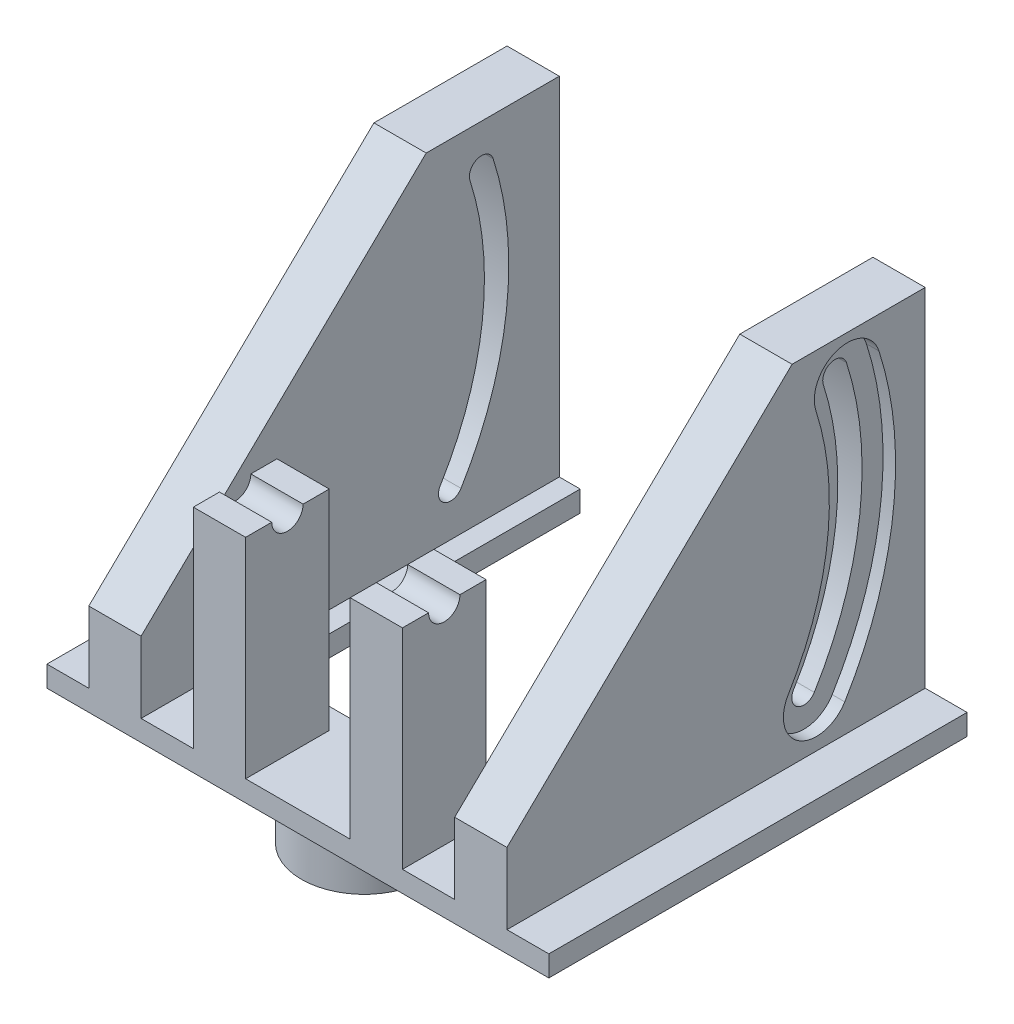
from build123d import *

# Parameters (mm, degrees)
AUFSATZ_LINEAR_AUSTRAGEN1_DEPTH = 10
SKIZZE2_W                       = 25
SKIZZE2_H                       = 40
AUFSATZ_LINEAR_AUSTRAGEN2_DEPTH = 100
SKIZZE3_R                       = 7.5
SCHNITT_LINEAR_AUSTRAGEN1_DEPTH = 285.604989415
SKIZZE4_W                       = 25
SKIZZE4_H                       = 200
AUFSATZ_LINEAR_AUSTRAGEN3_DEPTH = 200
SCHNITT_LINEAR_AUSTRAGEN4_REACH = 365.992
SCHNITT_LINEAR_AUSTRAGEN3_DEPTH = 364.992344743
SCHNITT_LINEAR_AUSTRAGEN5_DEPTH = 6
SKIZZE9_R                       = 30
AUFSATZ_LINEAR_AUSTRAGEN4_DEPTH = 20


with BuildPart() as part:
    # Skizze1 → Aufsatz-Linear austragen1 (new body)
    with BuildSketch(Plane(origin=(0, 0, 0), x_dir=(1, 0, 0), z_dir=(0, 1, 0))):
        Polygon((0, 0), (240, 0), (240, 200), (185, 200), (185, 50), (55, 50), (55, 200), (0, 200), align=None)
    extrude(amount=AUFSATZ_LINEAR_AUSTRAGEN1_DEPTH)

    # Skizze2 → Aufsatz-Linear austragen2 (add)
    with BuildSketch(Plane(origin=(0, 10, 0), x_dir=(1, 0, 0), z_dir=(0, 1, 0))):
        with Locations((157.5, 20)):
            Rectangle(SKIZZE2_W, SKIZZE2_H)
        with Locations((82.5, 20)):
            Rectangle(SKIZZE2_W, SKIZZE2_H)
    extrude(amount=AUFSATZ_LINEAR_AUSTRAGEN2_DEPTH)

    # Skizze3 → Schnitt-Linear austragen1 (cut, through all)
    with BuildSketch(Plane(origin=(170, 0, 0), x_dir=(0, 0, -1), z_dir=(1, 0, 0))):
        with Locations((20, 110)):
            Circle(SKIZZE3_R)
    extrude(amount=-SCHNITT_LINEAR_AUSTRAGEN1_DEPTH, mode=Mode.SUBTRACT)

    # Skizze4 → Aufsatz-Linear austragen3 (add)
    with BuildSketch(Plane(origin=(0, 10, 0), x_dir=(1, 0, 0), z_dir=(0, 1, 0))):
        with Locations((207.478242177, 100)):
            Rectangle(SKIZZE4_W, SKIZZE4_H)
        with Locations((32.521757823, 100)):
            Rectangle(SKIZZE4_W, SKIZZE4_H)
    extrude(amount=AUFSATZ_LINEAR_AUSTRAGEN3_DEPTH)

    # Skizze7 → Schnitt-Linear austragen4 (cut, up to next)
    with BuildSketch(Plane(origin=(219.978242177, 0, 0), x_dir=(0, 0, -1), z_dir=(1, 0, 0)), mode=Mode.PRIVATE) as schnitt_linear_austragen4_sk1:
        Polygon((0, 44.069377938), (136.337930206, 175.975272551), (200, 175.975272551), (200, 225.622509637), (-41.808038164, 225.622509637), align=None)
    schnitt_linear_austragen4_tool1 = extrude(schnitt_linear_austragen4_sk1.sketch, amount=-SCHNITT_LINEAR_AUSTRAGEN4_REACH, mode=Mode.PRIVATE) & part.part
    schnitt_linear_austragen4 = schnitt_linear_austragen4_tool1.solids().sort_by_distance((219.978242, 167.605519, -59.370877))[0]
    add(schnitt_linear_austragen4, mode=Mode.SUBTRACT)

    # Skizze6 → Schnitt-Linear austragen3 (cut, through all)
    with BuildSketch(Plane(origin=(219.978242177, 0, 0), x_dir=(0, 0, -1), z_dir=(1, 0, 0))):
        with BuildLine():
            ThreePointArc((152.985895116, 28.803269607), (174.718481208, 91.551452657), (168.349561926, 157.650443887))
            ThreePointArc((168.349561926, 157.650443887), (161.035471277, 161.408211518), (157.277703645, 154.094120869))
            ThreePointArc((157.277703645, 154.094120869), (163.171287707, 92.928333715), (143.060682227, 34.863271943))
            ThreePointArc((143.060682227, 34.863271943), (144.993287504, 26.870664331), (152.985895116, 28.803269607))
        make_face()
    extrude(amount=-SCHNITT_LINEAR_AUSTRAGEN3_DEPTH, mode=Mode.SUBTRACT)

    # Skizze8 → Schnitt-Linear austragen5 (cut)
    with BuildSketch(Plane(origin=(219.978242177, 0, 0), x_dir=(0, 0, -1), z_dir=(1, 0, 0))):
        with BuildLine():
            ThreePointArc((161.538964629, 23.581052028), (184.669295342, 90.364923006), (177.890755105, 160.715111448))
            ThreePointArc((177.890755105, 160.715111448), (157.970803716, 170.949404697), (147.736510466, 151.029453308))
            ThreePointArc((147.736510466, 151.029453308), (153.220473573, 94.114863367), (134.507612714, 40.085489522))
            ThreePointArc((134.507612714, 40.085489522), (139.771069924, 18.317594818), (161.538964629, 23.581052028))
        make_face()
    schnitt_linear_austragen5 = extrude(amount=-SCHNITT_LINEAR_AUSTRAGEN5_DEPTH, mode=Mode.SUBTRACT)

    # Spiegeln1: Schnitt-Linear austragen4, Schnitt-Linear austragen5 across plane
    add(schnitt_linear_austragen4.mirror(Plane(origin=(120, 0, 0), x_dir=(0, 0, 1), z_dir=(1, 0, 0))), mode=Mode.SUBTRACT)
    add(schnitt_linear_austragen5.mirror(Plane(origin=(120, 0, 0), x_dir=(0, 0, 1), z_dir=(1, 0, 0))), mode=Mode.SUBTRACT)

    # Skizze9 → Aufsatz-Linear austragen4 (add)
    with BuildSketch(Plane.XZ):
        with Locations(Location((120, -31.686005805, 0), (0, 0, 322.37676034))):
            Circle(SKIZZE9_R)
    extrude(amount=AUFSATZ_LINEAR_AUSTRAGEN4_DEPTH)


solid = part.part
